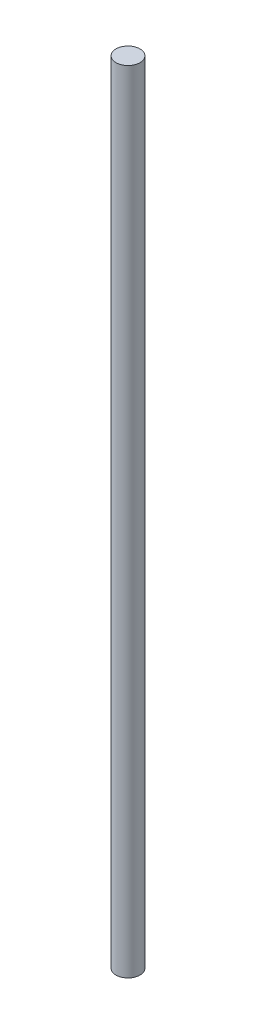
from build123d import *

# Parameters (mm, degrees)
SKETCH1_R           = 5
BOSS_EXTRUDE1_DEPTH = 330.2


with BuildPart() as part:
    # Sketch1 → Boss-Extrude1 (new body)
    with BuildSketch(Plane(origin=(0, 0, 0), x_dir=(1, 0, 0), z_dir=(0, 1, 0))):
        with Locations(Location((0, 0, 0), (0, 0, 270))):
            Circle(SKETCH1_R)
    extrude(amount=BOSS_EXTRUDE1_DEPTH)


solid = part.part
